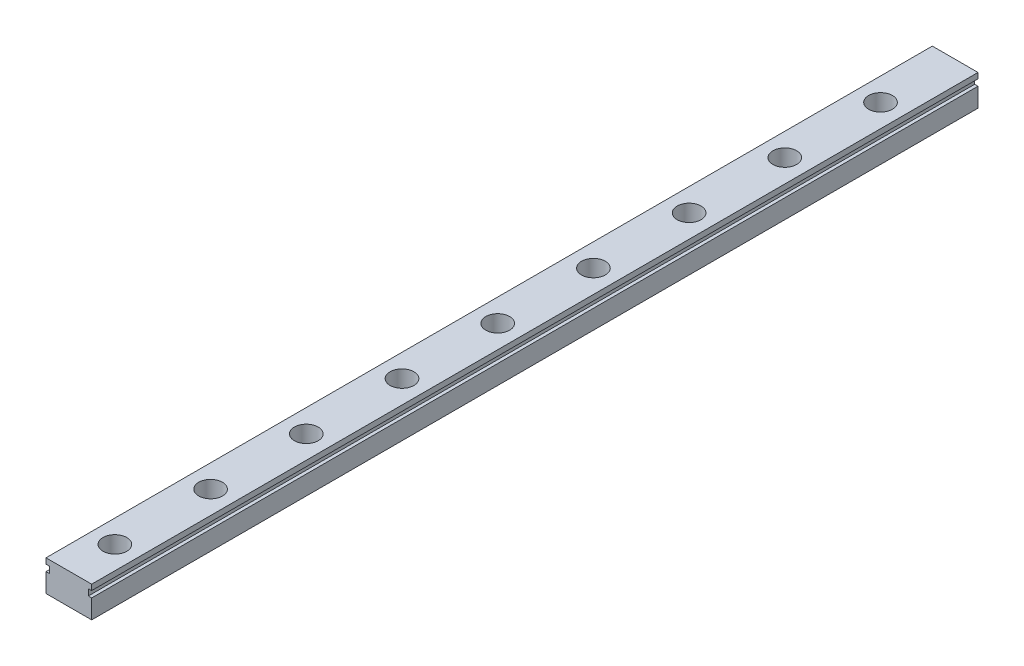
from build123d import *

# Parameters (mm, degrees)
SKETCH1_W           = 11.5
SKETCH1_H           = 7.8
BOSS_EXTRUDE1_DEPTH = 223.2
SKETCH2_W           = 0.835250229
SKETCH2_H           = 1.6
CUT_EXTRUDE1_DEPTH  = 224.308111138
SKETCH3_R           = 3
CUT_EXTRUDE2_DEPTH  = 4.7
SKETCH4_R           = 1.7
CUT_EXTRUDE3_DEPTH  = 224.323515331


with BuildPart() as part:
    # Sketch1 → Boss-Extrude1 (new body)
    with BuildSketch(Plane.XY):
        Rectangle(SKETCH1_W, SKETCH1_H)
    extrude(amount=BOSS_EXTRUDE1_DEPTH)

    # Sketch2 → Cut-Extrude1 (cut, through all)
    with BuildSketch(Plane.XY.offset(223.2)):
        with Locations((5.332374886, 1.7)):
            Rectangle(SKETCH2_W, SKETCH2_H)
        with Locations((-5.332374886, 1.7)):
            Rectangle(SKETCH2_W, SKETCH2_H)
    extrude(amount=-CUT_EXTRUDE1_DEPTH, mode=Mode.SUBTRACT)

    # Sketch3 → Cut-Extrude2 (cut)
    with BuildSketch(Plane(origin=(0, 3.9, 0), x_dir=(1, 0, 0), z_dir=(0, 1, 0))):
        with Locations(Location((0, -211.6, 0), (0, 0, 270))):
            Circle(SKETCH3_R)
        with Locations(Location((0, -187.5, 0), (0, 0, 270))):
            Circle(SKETCH3_R)
        with Locations(Location((0, -163.4, 0), (0, 0, 270))):
            Circle(SKETCH3_R)
        with Locations(Location((0, -139.3, 0), (0, 0, 270))):
            Circle(SKETCH3_R)
        with Locations(Location((0, -115.2, 0), (0, 0, 270))):
            Circle(SKETCH3_R)
        with Locations(Location((0, -91.1, 0), (0, 0, 270))):
            Circle(SKETCH3_R)
        with Locations(Location((0, -67, 0), (0, 0, 270))):
            Circle(SKETCH3_R)
        with Locations(Location((0, -42.9, 0), (0, 0, 270))):
            Circle(SKETCH3_R)
        with Locations(Location((0, -18.8, 0), (0, 0, 270))):
            Circle(SKETCH3_R)
    extrude(amount=-CUT_EXTRUDE2_DEPTH, mode=Mode.SUBTRACT)

    # Sketch4 → Cut-Extrude3 (cut, through all)
    with BuildSketch(Plane(origin=(0, -0.8, 0), x_dir=(1, 0, 0), z_dir=(0, 1, 0))):
        with Locations(Location((0, -211.6, 0), (0, 0, 270))):
            Circle(SKETCH4_R)
        with Locations(Location((0, -187.5, 0), (0, 0, 270))):
            Circle(SKETCH4_R)
        with Locations(Location((0, -163.4, 0), (0, 0, 270))):
            Circle(SKETCH4_R)
        with Locations(Location((0, -139.3, 0), (0, 0, 270))):
            Circle(SKETCH4_R)
        with Locations(Location((0, -115.2, 0), (0, 0, 270))):
            Circle(SKETCH4_R)
        with Locations(Location((0, -91.1, 0), (0, 0, 270))):
            Circle(SKETCH4_R)
        with Locations(Location((0, -67, 0), (0, 0, 270))):
            Circle(SKETCH4_R)
        with Locations(Location((0, -42.9, 0), (0, 0, 270))):
            Circle(SKETCH4_R)
        with Locations(Location((0, -18.8, 0), (0, 0, 270))):
            Circle(SKETCH4_R)
    extrude(amount=-CUT_EXTRUDE3_DEPTH, mode=Mode.SUBTRACT)


solid = part.part
